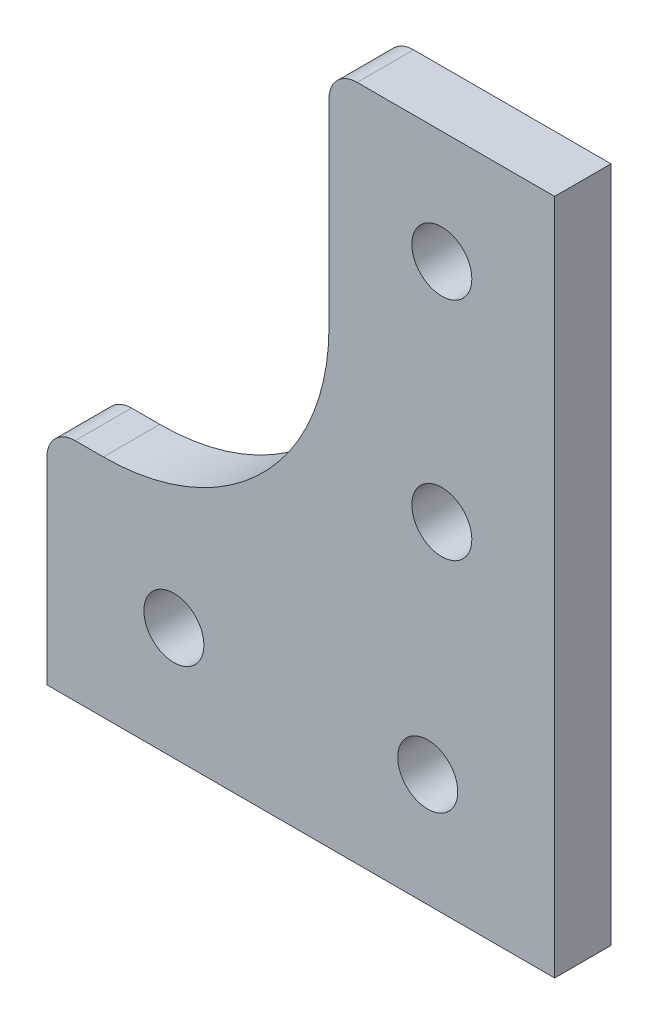
from build123d import *

# Parameters (mm, degrees)
BOSS_EXTRUDE1_DEPTH = 3.175
SKETCH2_R           = 3.3782
CUT_EXTRUDE1_DEPTH  = 70.922121857
SKETCH3_R           = 3.3782
CUT_EXTRUDE2_DEPTH  = 70.922121857
FILLET1_R           = 25.4
FILLET2_R           = 3.175


with BuildPart() as part:
    # Sketch1 → Boss-Extrude1 (new, symmetric)
    with BuildSketch(Plane.XY):
        Polygon((-28.575, -12.7), (28.575, -12.7), (28.575, 63.5), (3.175, 63.5), (3.175, 12.7), (-28.575, 12.7), align=None)
    extrude(amount=BOSS_EXTRUDE1_DEPTH, both=True)

    # Sketch2 → Cut-Extrude1 (cut, through all)
    with BuildSketch(Plane.XY.offset(3.175)):
        with Locations((15.875, 25.4)):
            Circle(SKETCH2_R)
        with Locations((15.875, 50.8)):
            Circle(SKETCH2_R)
    extrude(amount=-CUT_EXTRUDE1_DEPTH, mode=Mode.SUBTRACT)

    # Sketch3 → Cut-Extrude2 (cut, through all)
    with BuildSketch(Plane.XY.offset(3.175)):
        with Locations((-14.2875, 0)):
            Circle(SKETCH3_R)
        with Locations((14.2875, 0)):
            Circle(SKETCH3_R)
    extrude(amount=-CUT_EXTRUDE2_DEPTH, mode=Mode.SUBTRACT)

    # Fillet1
    fillet1_edges = [part.edges().sort_by_distance(p)[0] for p in [
        (3.175, 12.7, 0),
    ]]
    fillet(fillet1_edges, radius=FILLET1_R)

    # Fillet2
    fillet2_edges = [part.edges().sort_by_distance(p)[0] for p in [
        (-28.575, 12.7, 0),
        (3.175, 63.5, 0),
    ]]
    fillet(fillet2_edges, radius=FILLET2_R)


solid = part.part
